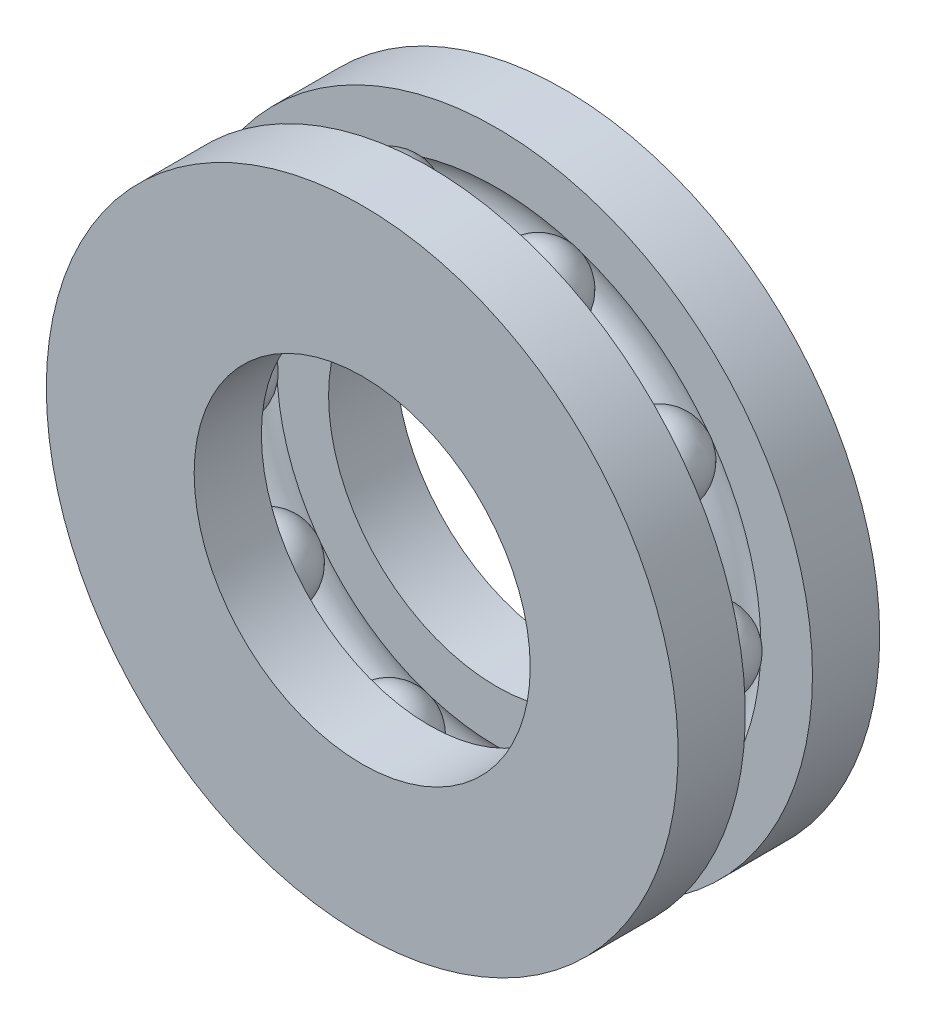
from build123d import *

# Parameters (mm, degrees)
SKETCH1_R           = 23.5
SKETCH1_R_2         = 12.5
BOSS_EXTRUDE1_DEPTH = 5
SKETCH3_R           = 23.5
SKETCH3_R_2         = 12.5
BOSS_EXTRUDE2_DEPTH = 5
SKETCH2_R           = 3
CIRPATTERN6_COUNT   = 10


with BuildPart() as part:
    # Sketch1 → Boss-Extrude1 (new body)
    with BuildSketch(Plane.XY):
        Circle(SKETCH1_R)
        Circle(SKETCH1_R_2, mode=Mode.SUBTRACT)
    extrude(amount=BOSS_EXTRUDE1_DEPTH)


with BuildPart() as body_2:
    # Sketch3 → Boss-Extrude2 (new body)
    with BuildSketch(Plane(origin=(0, 0, 15), x_dir=(-1, 0, 0), z_dir=(0, 0, -1))):
        with Locations(Location((0, 0, 0), (0, 0, 180))):
            Circle(SKETCH3_R)
        with Locations(Location((0, 0, 0), (0, 0, 180))):
            Circle(SKETCH3_R_2, mode=Mode.SUBTRACT)
    extrude(amount=BOSS_EXTRUDE2_DEPTH)


with BuildPart() as cut_revolve1_tool:
    # Sketch2 → Cut-Revolve1 (revolve)
    with BuildSketch(Plane(origin=(0, 0, 0), x_dir=(1, 0, 0), z_dir=(0, 1, 0))):
        with Locations((-18, -7.5)):
            Circle(SKETCH2_R)
    revolve(axis=Axis((0, 0, 0), (0, 0, 1)))


with BuildPart() as part_1:
    add(part.part)

    # Cut-Revolve1: cut by cut_revolve1_tool
    add(cut_revolve1_tool.part, mode=Mode.SUBTRACT)


with BuildPart() as body_2_1:
    add(body_2.part)

    # Cut-Revolve1: cut by cut_revolve1_tool
    add(cut_revolve1_tool.part, mode=Mode.SUBTRACT)


with BuildPart() as body_3:
    # Sketch4 → Revolve1 (revolve)
    with BuildSketch(Plane(origin=(0, 0, 0), x_dir=(1, 0, 0), z_dir=(0, 1, 0))):
        with BuildLine():
            Line((-18, -10.51), (-18, -4.49))
            ThreePointArc((-18, -4.49), (-21.01, -7.5), (-18, -10.51))
        make_face()
    revolve1 = revolve(axis=Axis((-18, 0, 9.678831593), (0, 0, -1)))


with BuildPart() as part_2:
    add(part_1.part)

    add(body_2_1.part)  # CirPattern6 merges body 2
    # CirPattern6: Revolve1 ×10 about axis
    cirpattern6_axis = Axis((0, 0, 0), (0, 0, 1))
    for i in range(1, CIRPATTERN6_COUNT):
        add(revolve1.rotate(cirpattern6_axis, i * 360 / CIRPATTERN6_COUNT))


solid = Compound([body_3.part, part_2.part])
